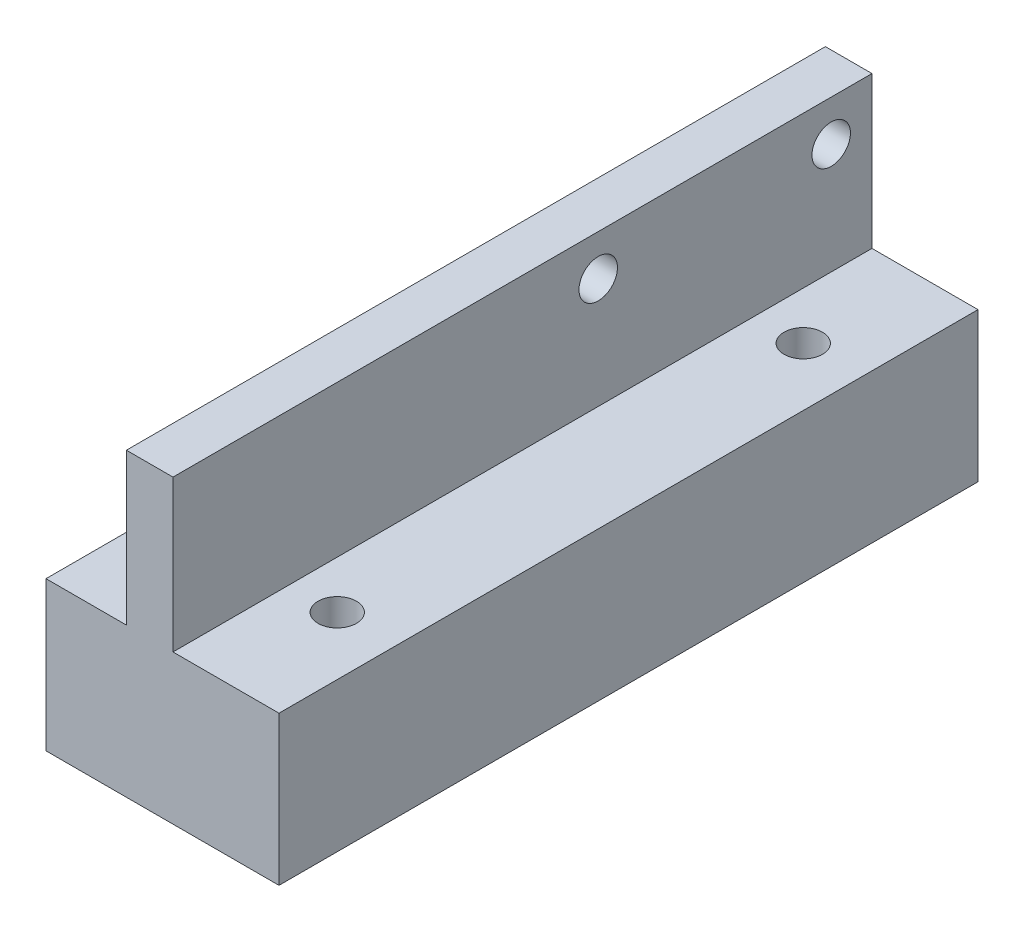
from build123d import *

# Parameters (mm, degrees)
SKETCH1_W           = 20
SKETCH1_H           = 60
SKETCH1_R           = 1.65
BOSS_EXTRUDE1_DEPTH = 12.8
SKETCH2_W           = 4
SKETCH2_H           = 60
BOSS_EXTRUDE3_DEPTH = 13
SKETCH3_R           = 1.65
CUT_EXTRUDE1_DEPTH  = 4


with BuildPart() as part:
    # Sketch1 → Boss-Extrude1 (new body)
    with BuildSketch(Plane(origin=(0, 0, 0), x_dir=(1, 0, 0), z_dir=(0, 1, 0))):
        Rectangle(SKETCH1_W, SKETCH1_H)
        with Locations(Location((5, 20, 0), (0, 0, 270))):
            Circle(SKETCH1_R, mode=Mode.SUBTRACT)
        with Locations(Location((5, -20, 0), (0, 0, 270))):
            Circle(SKETCH1_R, mode=Mode.SUBTRACT)
    extrude(amount=BOSS_EXTRUDE1_DEPTH)

    # Sketch2 → Boss-Extrude3 (add)
    with BuildSketch(Plane(origin=(0, 12.8, 0), x_dir=(1, 0, 0), z_dir=(0, 1, 0))):
        with Locations((-1.1, 0)):
            Rectangle(SKETCH2_W, SKETCH2_H)
    extrude(amount=BOSS_EXTRUDE3_DEPTH)

    # Sketch3 → Cut-Extrude1 (cut)
    with BuildSketch(Plane(origin=(0.9, 0, 0), x_dir=(0, 0, -1), z_dir=(1, 0, 0))):
        with Locations((6.5, 22.3)):
            Circle(SKETCH3_R)
        with Locations((26.5, 22.3)):
            Circle(SKETCH3_R)
    extrude(amount=-CUT_EXTRUDE1_DEPTH, mode=Mode.SUBTRACT)


solid = part.part
